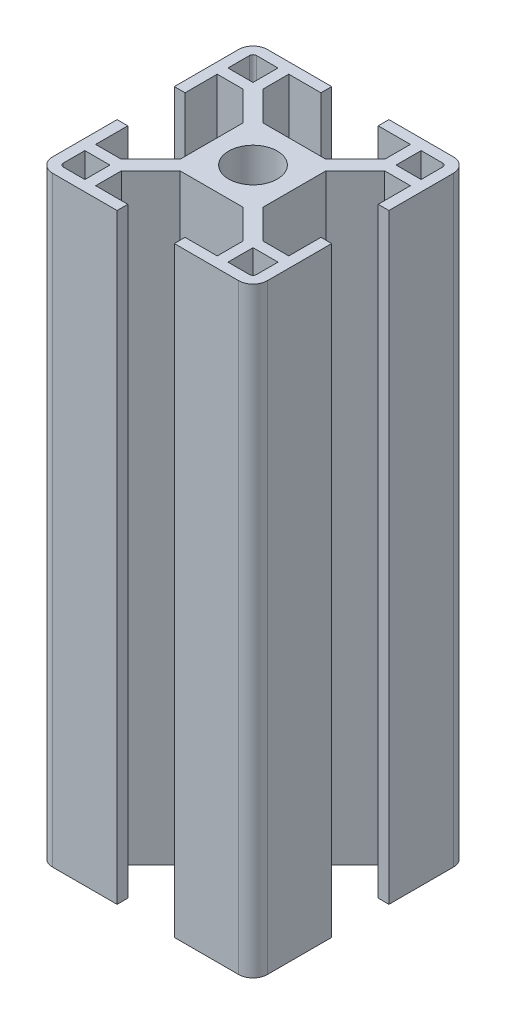
from build123d import *

# Parameters (mm, degrees)
SZKIC2_R                    = 3.4
DODANIE_WYCI_GNI_CIE1_DEPTH = 84


with BuildPart() as part:
    # Szkic2 → Dodanie-wyciągnięcie1 (new body)
    with BuildSketch(Plane(origin=(0, 0, 0), x_dir=(1, 0, 0), z_dir=(0, 1, 0))):
        with BuildLine():
            Line((15.000219073, 4.001445911), (15.000219073, 13.001445911))
            ThreePointArc((15.000219073, 13.001445911), (14.414432635, 14.415659474), (13.000219073, 15.001445911))
            Line((13.000219073, 15.001445911), (4.000219073, 15.001445911))
            Line((4.000219073, 15.001445911), (4.000219073, 13.501445911))
            Line((4.000219073, 13.501445911), (8.500219073, 13.501445911))
            Line((8.500219073, 13.501445911), (8.500219073, 9.915659474))
            Line((8.500219073, 9.915659474), (4.38600551, 5.801445911))
            Line((4.38600551, 5.801445911), (-4.385567365, 5.801445911))
            Line((-4.385567365, 5.801445911), (-8.499780927, 9.915659474))
            Line((-8.499780927, 9.915659474), (-8.499780927, 13.501445911))
            Line((-8.499780927, 13.501445911), (-3.999780927, 13.501445911))
            Line((-3.999780927, 13.501445911), (-3.999780927, 15.001445911))
            Line((-3.999780927, 15.001445911), (-12.999780927, 15.001445911))
            ThreePointArc((-12.999780927, 15.001445911), (-14.41399449, 14.415659474), (-14.999780927, 13.001445911))
            Line((-14.999780927, 13.001445911), (-14.999780927, 4.001445911))
            Line((-14.999780927, 4.001445911), (-13.499780927, 4.001445911))
            Line((-13.499780927, 4.001445911), (-13.499780927, 8.501445911))
            Line((-13.499780927, 8.501445911), (-9.91399449, 8.501445911))
            Line((-9.91399449, 8.501445911), (-5.799780927, 4.387232349))
            Line((-5.799780927, 4.387232349), (-5.799780927, -4.384340526))
            Line((-5.799780927, -4.384340526), (-9.91399449, -8.498554089))
            Line((-9.91399449, -8.498554089), (-13.499780927, -8.498554089))
            Line((-13.499780927, -8.498554089), (-13.499780927, -3.998554089))
            Line((-13.499780927, -3.998554089), (-14.999780927, -3.998554089))
            Line((-14.999780927, -3.998554089), (-14.999780927, -12.998554089))
            ThreePointArc((-14.999780927, -12.998554089), (-14.41399449, -14.412767651), (-12.999780927, -14.998554089))
            Line((-12.999780927, -14.998554089), (-3.999780927, -14.998554089))
            Line((-3.999780927, -14.998554089), (-3.999780927, -13.498554089))
            Line((-3.999780927, -13.498554089), (-8.499780927, -13.498554089))
            Line((-8.499780927, -13.498554089), (-8.499780927, -9.912767651))
            Line((-8.499780927, -9.912767651), (-4.385567365, -5.798554089))
            Line((-4.385567365, -5.798554089), (4.38600551, -5.798554089))
            Line((4.38600551, -5.798554089), (8.500219073, -9.912767651))
            Line((8.500219073, -9.912767651), (8.500219073, -13.498554089))
            Line((8.500219073, -13.498554089), (4.000219073, -13.498554089))
            Line((4.000219073, -13.498554089), (4.000219073, -14.998554089))
            Line((4.000219073, -14.998554089), (13.000219073, -14.998554089))
            ThreePointArc((13.000219073, -14.998554089), (14.414432635, -14.412767651), (15.000219073, -12.998554089))
            Line((15.000219073, -12.998554089), (15.000219073, -3.998554089))
            Line((15.000219073, -3.998554089), (13.500219073, -3.998554089))
            Line((13.500219073, -3.998554089), (13.500219073, -8.498554089))
            Line((13.500219073, -8.498554089), (9.914432635, -8.498554089))
            Line((9.914432635, -8.498554089), (5.800219073, -4.384340526))
            Line((5.800219073, -4.384340526), (5.800219073, 4.387232349))
            Line((5.800219073, 4.387232349), (9.914432635, 8.501445911))
            Line((9.914432635, 8.501445911), (13.500219073, 8.501445911))
            Line((13.500219073, 8.501445911), (13.500219073, 4.001445911))
            Line((13.500219073, 4.001445911), (15.000219073, 4.001445911))
        make_face()
        with Locations(Location((0, 0, 0), (0, 0, 90))):
            Circle(SZKIC2_R, mode=Mode.SUBTRACT)
        with BuildLine():
            Line((10.001445911, -10.000219073), (13.501445911, -10.000219073))
            Line((13.501445911, -10.000219073), (13.501445911, -13.000219073))
            ThreePointArc((13.501445911, -13.000219073), (13.354999302, -13.353772463), (13.001445911, -13.500219073))
            Line((13.001445911, -13.500219073), (10.001445911, -13.500219073))
            Line((10.001445911, -13.500219073), (10.001445911, -10.000219073))
        make_face(mode=Mode.SUBTRACT)
        with BuildLine():
            Line((10.000219073, 10.001445911), (13.500219073, 10.001445911))
            Line((13.500219073, 10.001445911), (13.500219073, 13.001445911))
            ThreePointArc((13.500219073, 13.001445911), (13.353772463, 13.354999302), (13.000219073, 13.501445911))
            Line((13.000219073, 13.501445911), (10.000219073, 13.501445911))
            Line((10.000219073, 13.501445911), (10.000219073, 10.001445911))
        make_face(mode=Mode.SUBTRACT)
        with BuildLine():
            Line((-10.000219073, -10.001445911), (-10.000219073, -13.501445911))
            Line((-10.000219073, -13.501445911), (-13.000219073, -13.501445911))
            ThreePointArc((-13.000219073, -13.501445911), (-13.353772463, -13.354999302), (-13.500219073, -13.001445911))
            Line((-13.500219073, -13.001445911), (-13.500219073, -10.001445911))
            Line((-13.500219073, -10.001445911), (-10.000219073, -10.001445911))
        make_face(mode=Mode.SUBTRACT)
        with BuildLine():
            Line((-10.001445911, 10.000219073), (-13.501445911, 10.000219073))
            Line((-13.501445911, 10.000219073), (-13.501445911, 13.000219073))
            ThreePointArc((-13.501445911, 13.000219073), (-13.354999302, 13.353772463), (-13.001445911, 13.500219073))
            Line((-13.001445911, 13.500219073), (-10.001445911, 13.500219073))
            Line((-10.001445911, 13.500219073), (-10.001445911, 10.000219073))
        make_face(mode=Mode.SUBTRACT)
    extrude(amount=DODANIE_WYCI_GNI_CIE1_DEPTH)


solid = part.part
